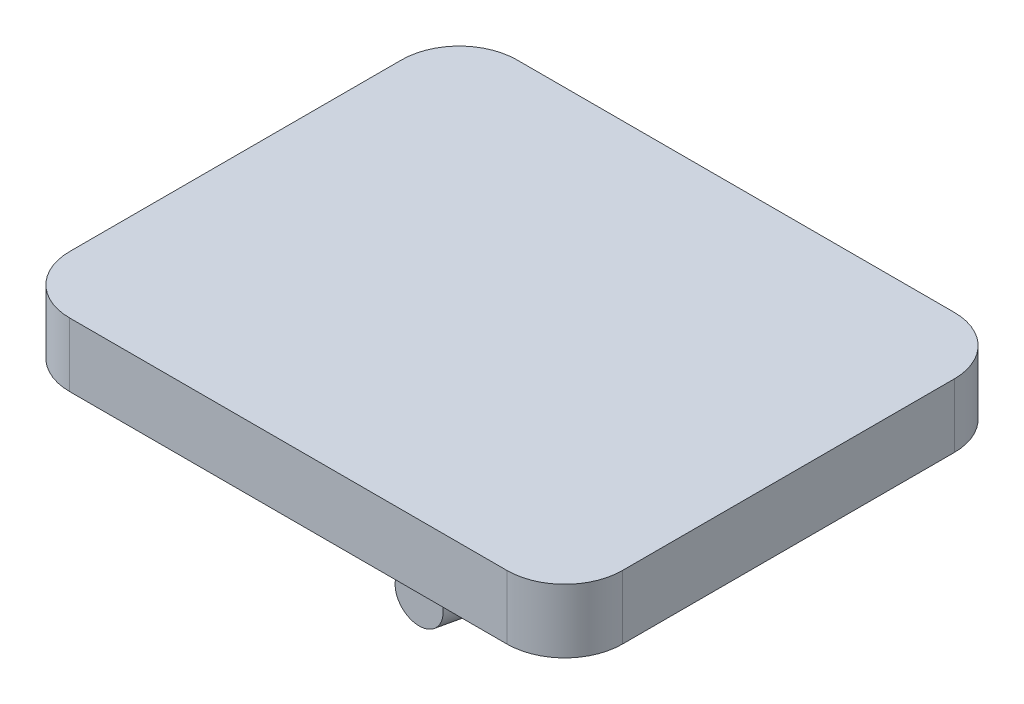
from build123d import *

# Parameters (mm, degrees)
BOSS_EXTRUDE1_DEPTH      = 33.2
BOSS_EXTRUDE2_DEPTH      = 5
BOSS_EXTRUDE2_DEPTH_BACK = 5
SKETCH4_W                = 83.511672616
SKETCH4_H                = 9.134615549
SKETCH5_R                = 32
BOSS_EXTRUDE3_DEPTH      = 5
SKETCH6_R                = 2.5
CUT_EXTRUDE1_DEPTH       = 5


with BuildPart() as part:
    # Sketch2 → Boss-Extrude1 (new body)
    with BuildSketch(Plane(origin=(0, 0, 0), x_dir=(1, 0, 0), z_dir=(0, 1, 0))):
        with BuildLine():
            ThreePointArc((-143.85, -86.4), (-135.063203436, -107.613203436), (-113.85, -116.4))
            Line((-113.85, -116.4), (113.85, -116.4))
            ThreePointArc((113.85, -116.4), (135.063203436, -107.613203436), (143.85, -86.4))
            Line((143.85, -86.4), (143.85, 86.4))
            ThreePointArc((143.85, 86.4), (135.063203436, 107.613203436), (113.85, 116.4))
            Line((113.85, 116.4), (-113.85, 116.4))
            ThreePointArc((-113.85, 116.4), (-135.063203436, 107.613203436), (-143.85, 86.4))
            Line((-143.85, 86.4), (-143.85, -86.4))
        make_face()
    extrude(amount=BOSS_EXTRUDE1_DEPTH)



with BuildPart() as body_2:
    # Sketch3 → Revolve2 (revolve)
    with BuildSketch(Plane(origin=(39.95, 0, 0), x_dir=(0, 0, -1), z_dir=(1, 0, 0))):
        Polygon((85.6, -30.3), (85.6, -5.3), (-1.35, -5.3), (-88.3, -17.8), (-88.3, -30.3), align=None)
    revolve(axis=Axis((39.95, -30.3, -85.6), (0, 0, 1)))


with BuildPart() as part_1:
    add(part.part)

    add(body_2.part)  # Boss-Extrude2 merges body 2
    # Sketch4 → Boss-Extrude2 (add, two sides: drawn at the far end of the back side and taken through both)
    with BuildSketch(Plane(origin=(39.95, 0, 0), x_dir=(0, 0, -1), z_dir=(1, 0, 0)).offset(-BOSS_EXTRUDE2_DEPTH_BACK)):
        with Locations((41.755836308, -4.567307775)):
            Rectangle(SKETCH4_W, SKETCH4_H)
    extrude(amount=BOSS_EXTRUDE2_DEPTH + BOSS_EXTRUDE2_DEPTH_BACK)

    # Sketch5 → Boss-Extrude3 (add)
    with BuildSketch(Plane.XZ):
        with Locations(Location((-108.35, -70, 0), (0, 0, 90))):
            Circle(SKETCH5_R)
    extrude(amount=BOSS_EXTRUDE3_DEPTH)

    # Sketch6 → Cut-Extrude1 (cut)
    with BuildSketch(Plane.XZ):
        with Locations(Location((113.85, -86.4, 0), (0, 0, 270))):
            Circle(SKETCH6_R)
        with Locations(Location((0, -86.4, 0), (0, 0, 270))):
            Circle(SKETCH6_R)
        with Locations(Location((113.85, 86.4, 0), (0, 0, 270))):
            Circle(SKETCH6_R)
        with Locations(Location((0, 86.4, 0), (0, 0, 270))):
            Circle(SKETCH6_R)
        with Locations(Location((-113.85, 86.4, 0), (0, 0, 270))):
            Circle(SKETCH6_R)
    extrude(amount=-CUT_EXTRUDE1_DEPTH, mode=Mode.SUBTRACT)


solid = part_1.part
